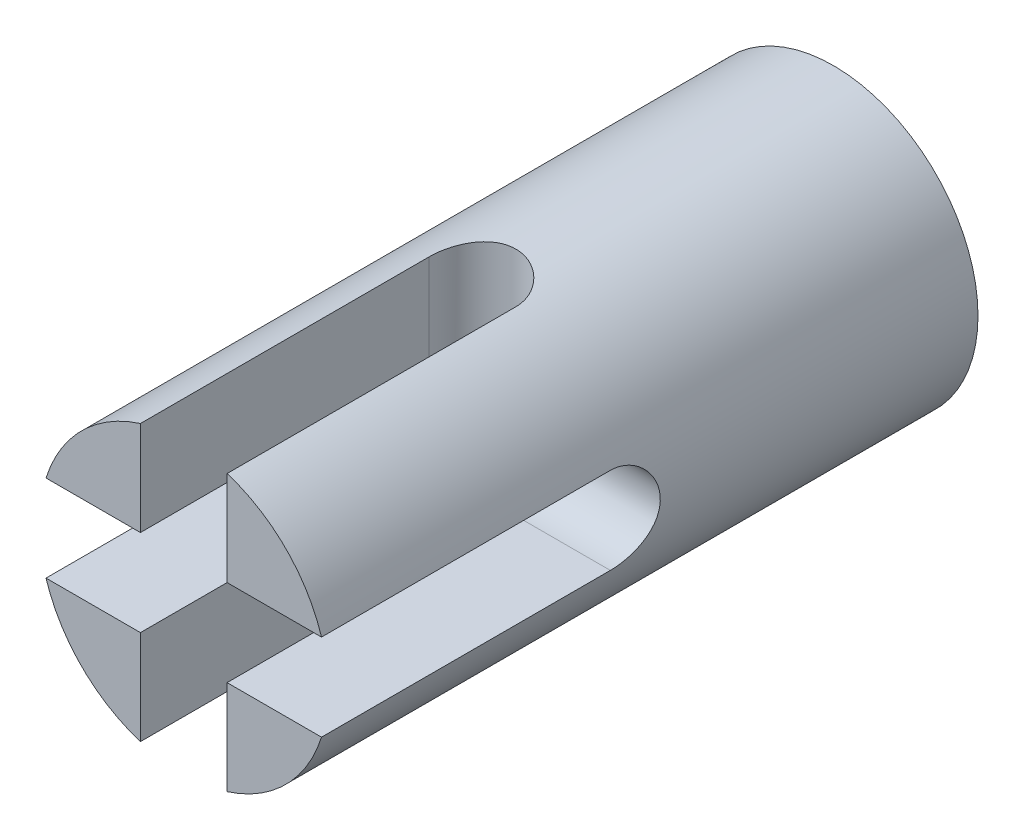
from build123d import *

# Parameters (mm, degrees)
SKETCH_1_R          = 10
EXTRUDE_1_DEPTH     = 45
CUT_EXTRUDE_1_DEPTH = 22.5
SKETCH_4_W          = 29.063503474
SKETCH_4_H          = 6
CUT_EXTRUDE_2_DEPTH = 20
SKETCH_5_R          = 2.25
CUT_EXTRUDE_3_DEPTH = 15
SKETCH_6_R          = 3
CUT_EXTRUDE_4_DEPTH = 23


with BuildPart() as part:
    # 草图1 → 凸台-拉伸1 (new body)
    with BuildSketch(Plane.XY):
        with Locations(Location((0, 0, 0), (0, 0, 180))):
            Circle(SKETCH_1_R)
    extrude(amount=EXTRUDE_1_DEPTH)

    # 草图2 → 切除-拉伸1 (cut, symmetric)
    with BuildSketch(Plane(origin=(0, 0, 0), x_dir=(1, 0, 0), z_dir=(0, 1, 0))):
        with BuildLine():
            Line((3, -45), (3, -25))
            ThreePointArc((3, -25), (0, -22), (-3, -25))
            Line((-3, -25), (-3, -45))
            Line((-3, -45), (3, -45))
        make_face()
    extrude(amount=CUT_EXTRUDE_1_DEPTH, both=True, mode=Mode.SUBTRACT)

    # 草图4 → 切除-拉伸2 (cut)
    with BuildSketch(Plane.XY.offset(45)):
        Rectangle(SKETCH_4_W, SKETCH_4_H)
    extrude(amount=-CUT_EXTRUDE_2_DEPTH, mode=Mode.SUBTRACT)

    # 草图5 → 切除-拉伸3 (cut)
    with BuildSketch(Plane(origin=(0, 0, 0), x_dir=(-1, 0, 0), z_dir=(0, 0, -1))):
        Circle(SKETCH_5_R)
    extrude(amount=-CUT_EXTRUDE_3_DEPTH, mode=Mode.SUBTRACT)

    # 草图6 → 切除-拉伸4 (cut, symmetric)
    with BuildSketch(Plane.ZY):
        with Locations((25, 0)):
            Circle(SKETCH_6_R)
    extrude(amount=CUT_EXTRUDE_4_DEPTH, both=True, mode=Mode.SUBTRACT)


solid = part.part
